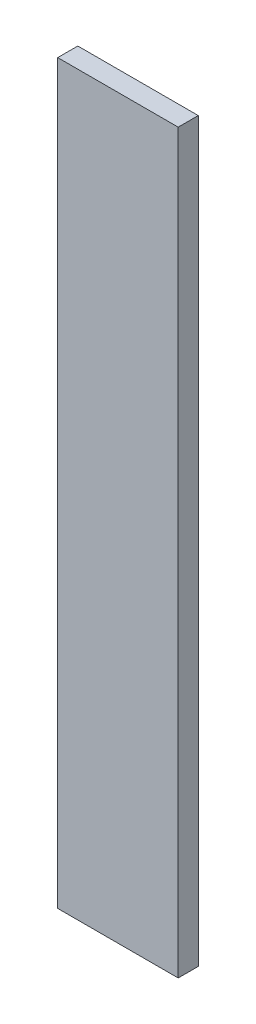
from build123d import *

# Parameters (mm, degrees)
SKETCH1_W           = 30
SKETCH1_H           = 183.5
BOSS_EXTRUDE1_DEPTH = 5


with BuildPart() as part:
    # Sketch1 → Boss-Extrude1 (new body)
    with BuildSketch(Plane.XY):
        Rectangle(SKETCH1_W, SKETCH1_H)
    extrude(amount=BOSS_EXTRUDE1_DEPTH)


solid = part.part
